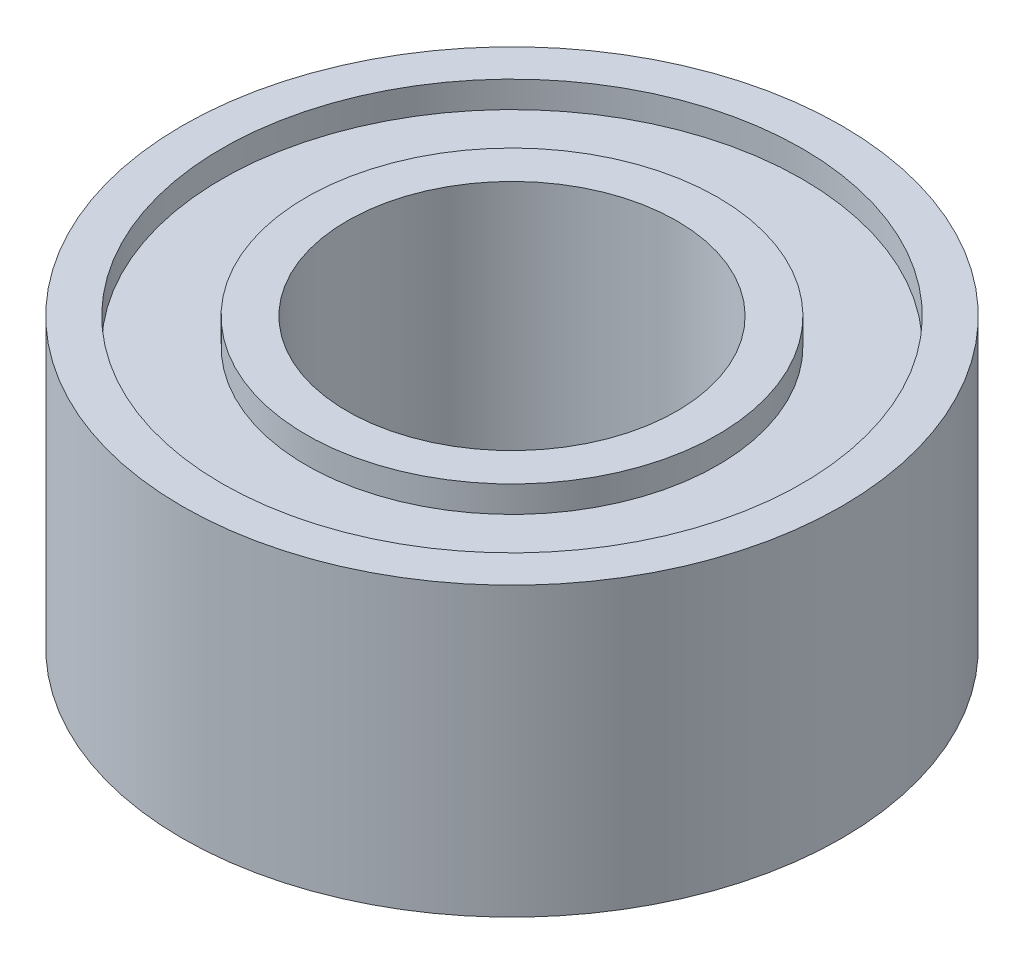
from build123d import *


with BuildPart() as part:
    # Sketch1 → Revolve1 (revolve)
    with BuildSketch(Plane.XY, mode=Mode.PRIVATE) as revolve1_sk:
        Polygon((1.9812, 1.3843), (1.5875, 1.3843), (1.5875, -1.3843), (1.9812, -1.3843), (1.9812, -1.1303), (2.794, -1.1303), (2.794, -1.3843), (3.175, -1.3843), (3.175, 1.3843), (2.794, 1.3843), (2.794, 1.1303), (1.9812, 1.1303), align=None)
    revolve(revolve1_sk.sketch.rotate(Axis((0, 1.3843, 0), (0, -1, 0)), 270), axis=Axis((0, 1.3843, 0), (0, -1, 0)))


solid = part.part
